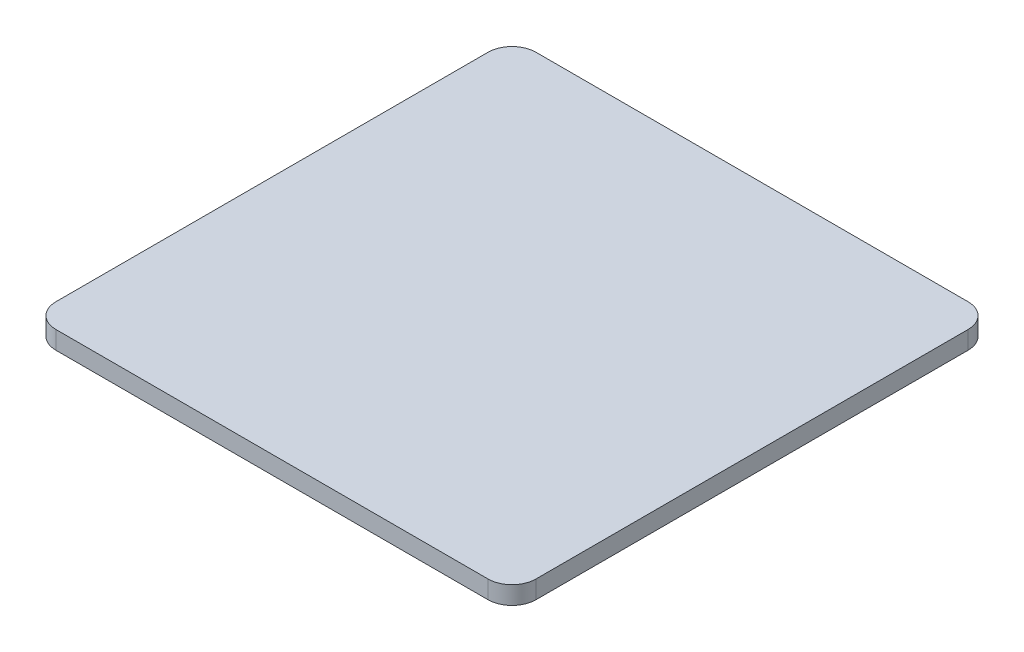
from build123d import *

# Parameters (mm, degrees)
SKETCH1_W           = 80
SKETCH1_H           = 80
BOSS_EXTRUDE1_DEPTH = 3
FILLET1_R           = 4


with BuildPart() as part:
    # Sketch1 → Boss-Extrude1 (new body)
    with BuildSketch(Plane(origin=(0, 0, 0), x_dir=(1, 0, 0), z_dir=(0, 1, 0))):
        Rectangle(SKETCH1_W, SKETCH1_H)
    extrude(amount=BOSS_EXTRUDE1_DEPTH)

    # Fillet1
    fillet1_edges = [part.edges().sort_by_distance(p)[0] for p in [
        (40, 1.5, 40),
        (-40, 1.5, 40),
        (-40, 1.5, -40),
        (40, 1.5, -40),
    ]]
    fillet(fillet1_edges, radius=FILLET1_R)


solid = part.part
